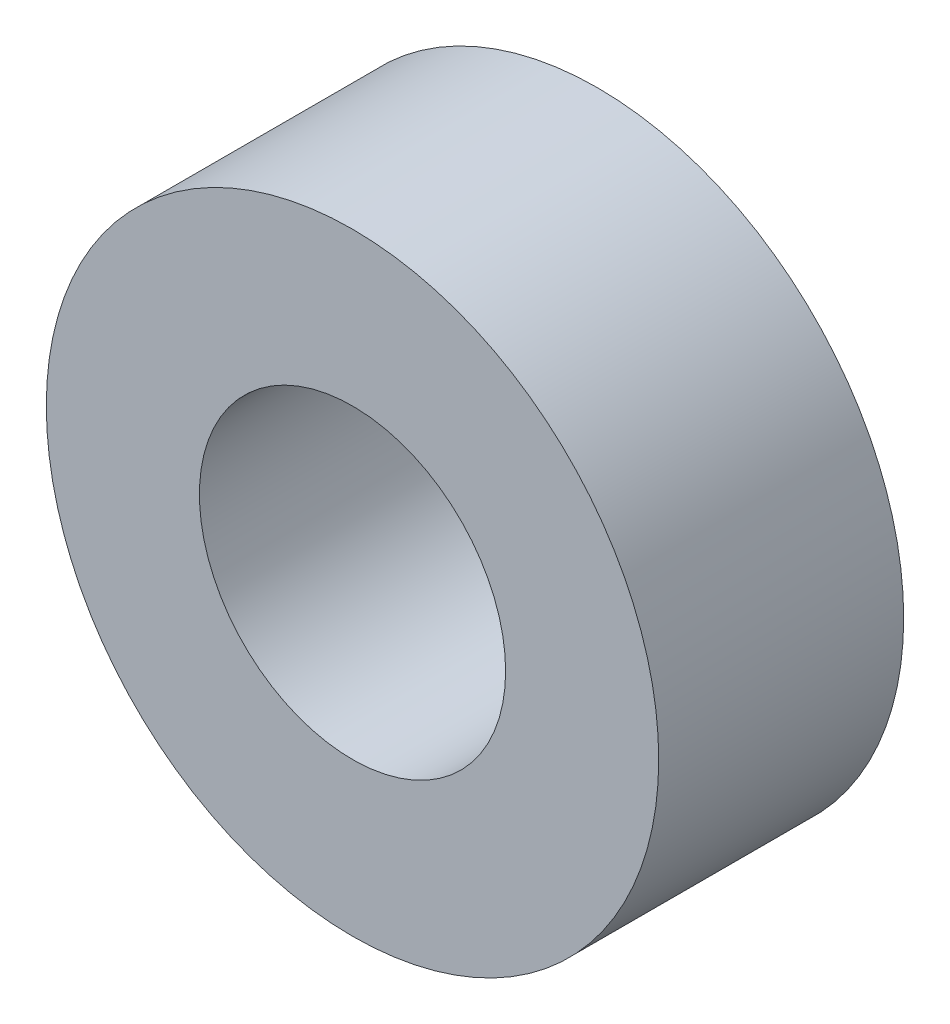
from build123d import *

# Parameters (mm, degrees)
SKETCH_1_R      = 2.5
SKETCH_1_R_2    = 1.25
EXTRUDE_1_DEPTH = 2


with BuildPart() as part:
    # Эскиз1 → Бобышка-Вытянуть1 (new body)
    with BuildSketch(Plane.XY):
        Circle(SKETCH_1_R)
        Circle(SKETCH_1_R_2, mode=Mode.SUBTRACT)
    extrude(amount=EXTRUDE_1_DEPTH)


solid = part.part
